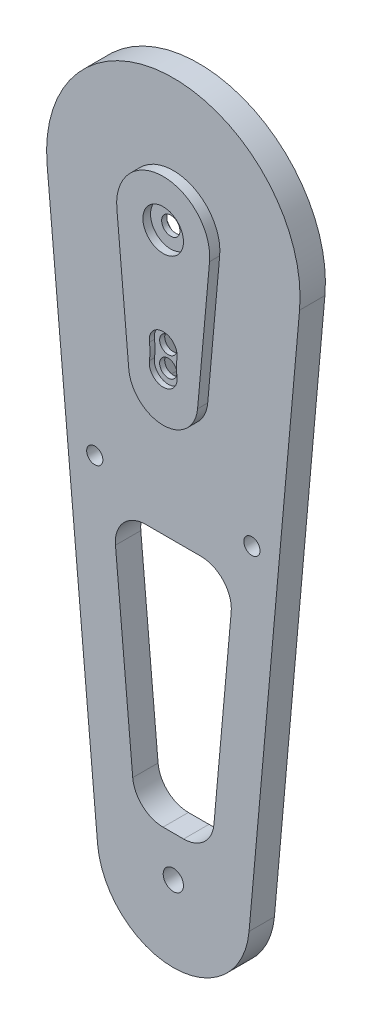
from build123d import *

# Parameters (mm, degrees)
CROQUIS1_R                                           = 2
SALIENTE_EXTRUIR1_DEPTH                              = 5
CROQUIS11_R                                          = 1.6
CORTAR_EXTRUIR1_DEPTH                                = 6
CORTAR_EXTRUIR2_REACH                                = 141.352
CROQUIS13_R                                          = 1.8
SALIENTE_EXTRUIR2_DEPTH                              = 2
SALIENTE_EXTRUIR3_START                              = -0.5
CROQUIS13_3_R                                        = 4
CROQUIS13_3_R_2                                      = 1.8
SALIENTE_EXTRUIR3_DEPTH                              = 0.5
CORTAR_EXTRUIR3_START                                = -1.5
CROQUIS14_R                                          = 4
CORTAR_EXTRUIR3_DEPTH                                = 1.5
CHAFL_N1_SIZE                                        = 0.5
REFRENTADO_PARA_TORNILLO_CON_CABEZA_TRON_D           = 3.4
REFRENTADO_PARA_TORNILLO_CON_CABEZA_TRON_CBORE_D     = 5.5
REFRENTADO_PARA_TORNILLO_CON_CABEZA_TRON_CBORE_DEPTH = 1
REDONDEO1_R                                          = 10
REDONDEO2_R                                          = 6


with BuildPart() as part:
    # Croquis1 → Saliente-Extruir1 (new body)
    with BuildSketch(Plane.XY):
        with BuildLine():
            Line((-24.90015137, 109.767857143), (-14.940090822, -1.339285714))
            ThreePointArc((-14.940090822, -1.339285714), (0, -15), (14.940090822, -1.339285714))
            Line((14.940090822, -1.339285714), (24.90015137, 109.767857143))
            ThreePointArc((24.90015137, 109.767857143), (0, 137), (-24.90015137, 109.767857143))
        make_face()
        Circle(CROQUIS1_R, mode=Mode.SUBTRACT)
        with BuildLine():
            ThreePointArc((0, 79.505), (-2.510229073, 80.544770927), (-3.55, 83.055))
            Line((-3.55, 83.055), (-3.55, 100.917467573))
            ThreePointArc((-3.55, 100.917467573), (-4.131760905, 104.278534717), (-5.80935447, 107.248534369))
            ThreePointArc((-5.80935447, 107.248534369), (-6.670864673, 115.438690086), (0.5, 119.488325914))
            ThreePointArc((0.5, 119.488325914), (5.480762949, 117.127013019), (7.505, 112))
            ThreePointArc((7.505, 112), (7.068388441, 109.477519108), (5.80935447, 107.248534369))
            ThreePointArc((5.80935447, 107.248534369), (4.131760905, 104.278534717), (3.55, 100.917467573))
            Line((3.55, 100.917467573), (3.55, 83.055))
            ThreePointArc((3.55, 83.055), (2.510229073, 80.544770927), (0, 79.505))
        make_face(mode=Mode.SUBTRACT)
    extrude(amount=SALIENTE_EXTRUIR1_DEPTH)

    # Croquis11 → Cortar-Extruir1 (cut)
    with BuildSketch(Plane(origin=(0, 0, 0), x_dir=(-1, 0, 0), z_dir=(0, 0, -1))):
        with Locations((-15.5, 64.768083746)):
            Circle(CROQUIS11_R)
        with Locations(Location((15.5, 64.768083746, 0), (0, 0, 180))):
            Circle(CROQUIS11_R)
    extrude(amount=-CORTAR_EXTRUIR1_DEPTH, mode=Mode.SUBTRACT)

    # Croquis12 → Cortar-Extruir2 (cut, up to next)
    with BuildSketch(Plane.XY.offset(5), mode=Mode.PRIVATE) as cortar_extruir2_sk1:
        Polygon((-12, 58), (12, 58), (7.517812675, 8), (-7.517812675, 8), align=None)
    cortar_extruir2_tool1 = extrude(cortar_extruir2_sk1.sketch, amount=-CORTAR_EXTRUIR2_REACH, mode=Mode.PRIVATE) & part.part
    add(cortar_extruir2_tool1.solids().sort_by_distance((0, 34.913717, 5))[0], mode=Mode.SUBTRACT)

    # Croquis13 → Saliente-Extruir2 (add)
    with BuildSketch(Plane.XY.offset(5)):
        with BuildLine():
            Line((6.784704059, 84.864496193), (9.143753072, 111.180319718))
            ThreePointArc((9.143753072, 111.180319718), (0, 121.180419163), (-9.143753072, 111.180319718))
            Line((-9.143753072, 111.180319718), (-6.784704059, 84.864496193))
            ThreePointArc((-6.784704059, 84.864496193), (0, 78.660792028), (6.784704059, 84.864496193))
        make_face()
        with Locations((0, 112)):
            Circle(CROQUIS13_R, mode=Mode.SUBTRACT)
    extrude(amount=SALIENTE_EXTRUIR2_DEPTH)

    # Croquis13<3> → Saliente-Extruir3 (add)
    with BuildSketch(Plane.XY.offset(5).offset(SALIENTE_EXTRUIR3_START)):
        with Locations((0, 112)):
            Circle(CROQUIS13_3_R)
        with Locations((0, 112)):
            Circle(CROQUIS13_3_R_2, mode=Mode.SUBTRACT)
    extrude(amount=SALIENTE_EXTRUIR3_DEPTH)

    # Croquis14 → Cortar-Extruir3 (cut)
    with BuildSketch(Plane.XY.offset(7).offset(CORTAR_EXTRUIR3_START)):
        with Locations((0, 112)):
            Circle(CROQUIS14_R)
    extrude(amount=CORTAR_EXTRUIR3_DEPTH, mode=Mode.SUBTRACT)

    # Chaflán1
    chafl_n1_edges = [part.edges().sort_by_distance(p)[0] for p in [
        (3.55, 91.986233786, 0),
        (4.131760905, 104.278534717, 0),
        (-2.522480892, 119.068388441, 0),
        (-4.131760905, 104.278534717, 0),
        (-3.55, 91.986233786, 0),
        (0, 79.505, 0),
    ]]
    chamfer(chafl_n1_edges, length=CHAFL_N1_SIZE)

    # Refrentado para tornillo con cabeza troncocónica de M31 (through all)
    with Locations(Plane(origin=(0, 0, 7), x_dir=(-1, 0, 0), z_dir=(0, 0, 1))):
        with Locations((0, -91.915), (0, -87.915)):
            CounterBoreHole(REFRENTADO_PARA_TORNILLO_CON_CABEZA_TRON_D / 2, REFRENTADO_PARA_TORNILLO_CON_CABEZA_TRON_CBORE_D / 2, REFRENTADO_PARA_TORNILLO_CON_CABEZA_TRON_CBORE_DEPTH)

    # Redondeo1
    redondeo1_edges = [part.edges().sort_by_distance(p)[0] for p in [
        (-1.887458609, 89.915, 6.5),
        (1.887458609, 89.915, 6.5),
    ]]
    fillet(redondeo1_edges, radius=REDONDEO1_R)

    # Redondeo2
    redondeo2_edges = [part.edges().sort_by_distance(p)[0] for p in [
        (7.517812675, 8, 2.5),
        (-7.517812675, 8, 2.5),
        (-12, 58, 2.5),
        (12, 58, 2.5),
    ]]
    fillet(redondeo2_edges, radius=REDONDEO2_R)


solid = part.part
